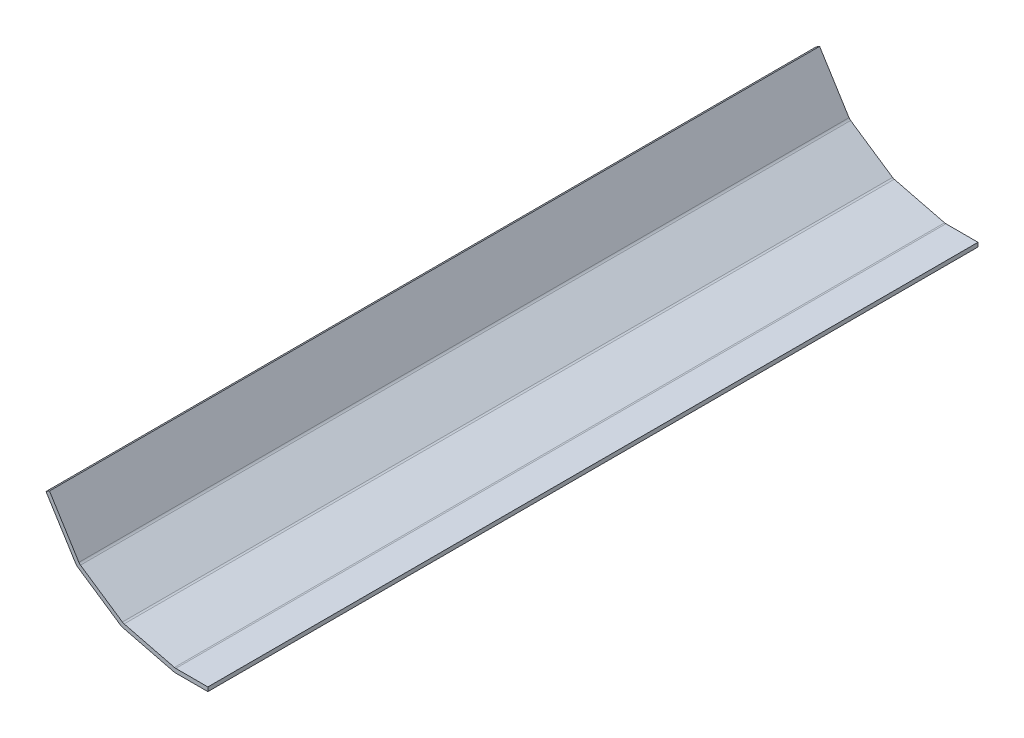
from build123d import *

# Parameters (mm, degrees)
TANGENT_BEND_SECTION_FORMED_STATE_DEPTH = 282


with BuildPart() as part:
    # Tangent bend section, formed state profile → Tangent bend section, formed state (new body)
    with BuildSketch(Plane.XY):
        with BuildLine():
            Line((152, 3), (140.245569122, 3))
            ThreePointArc((140.245569122, 3), (140.001830435, 3.014907697), (139.761725331, 3.059408547))
            Line((139.761725331, 3.059408547), (121.342178632, 7.651917339))
            ThreePointArc((121.342178632, 7.651917339), (121.012549137, 7.765417876), (120.707636616, 7.934433647))
            Line((120.707636616, 7.934433647), (105.352434752, 18.291648082))
            ThreePointArc((105.352434752, 18.291648082), (105.032140958, 18.560406486), (104.774724366, 18.889884698))
            Line((104.774724366, 18.889884698), (94, 36.133048143))
            Line((94, 36.133048143), (92.727927856, 35.338169247))
            Line((92.727927856, 35.338169247), (103.502652222, 18.095005802))
            ThreePointArc((103.502652222, 18.095005802), (103.953131258, 17.51841893), (104.513645397, 17.048091723))
            Line((104.513645397, 17.048091723), (119.868847261, 6.690877288))
            ThreePointArc((119.868847261, 6.690877288), (120.402444172, 6.39509969), (120.979295788, 6.19647375))
            Line((120.979295788, 6.19647375), (139.398842487, 1.603964958))
            ThreePointArc((139.398842487, 1.603964958), (139.81902642, 1.52608847), (140.245569122, 1.5))
            Line((140.245569122, 1.5), (152, 1.5))
            Line((152, 1.5), (152, 3))
        make_face()
    extrude(amount=TANGENT_BEND_SECTION_FORMED_STATE_DEPTH)


solid = part.part
